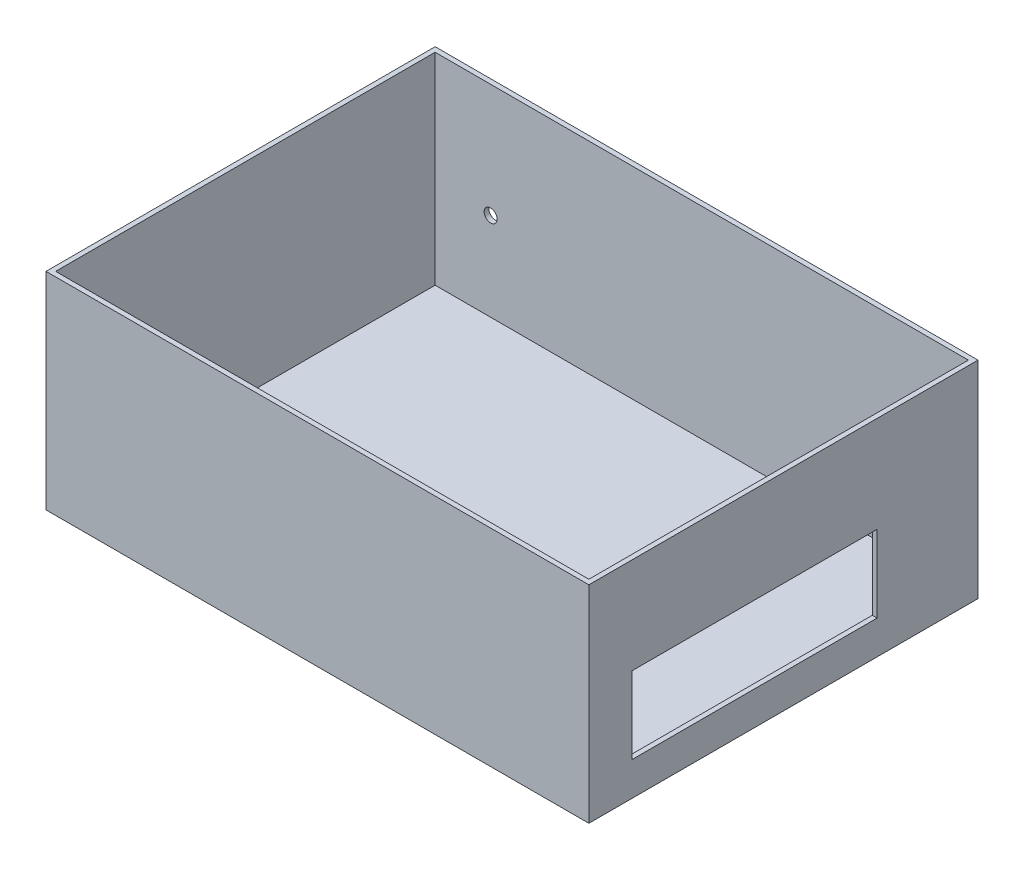
from build123d import *

# Parameters (mm, degrees)
SKETCH1_W           = 113
SKETCH1_H           = 81
BOSS_EXTRUDE1_DEPTH = 1
SKETCH2_W           = 113
SKETCH2_H           = 81
SKETCH2_W_2         = 111
SKETCH2_H_2         = 79
BOSS_EXTRUDE3_DEPTH = 42
CUT_EXTRUDE2_REACH  = 129.508
SKETCH3_W           = 51
SKETCH3_H           = 16
SKETCH4_R           = 1.55
SKETCH4_R_2         = 0.55
BOSS_EXTRUDE4_DEPTH = 1.1
CUT_EXTRUDE3_REACH  = 109.714
SKETCH6_R           = 1.35


with BuildPart() as part:
    # Sketch1 → Boss-Extrude1 (new body)
    with BuildSketch(Plane(origin=(0, 0, 0), x_dir=(1, 0, 0), z_dir=(0, 1, 0))):
        Rectangle(SKETCH1_W, SKETCH1_H)
    extrude(amount=BOSS_EXTRUDE1_DEPTH)

    # Sketch2 → Boss-Extrude3 (add)
    with BuildSketch(Plane(origin=(0, 1, 0), x_dir=(1, 0, 0), z_dir=(0, 1, 0))):
        Rectangle(SKETCH2_W, SKETCH2_H)
        Rectangle(SKETCH2_W_2, SKETCH2_H_2, mode=Mode.SUBTRACT)
    extrude(amount=BOSS_EXTRUDE3_DEPTH)

    # Sketch3 → Cut-Extrude2 (cut, up to next)
    with BuildSketch(Plane(origin=(56.5, 0, 0), x_dir=(0, 0, -1), z_dir=(1, 0, 0)), mode=Mode.PRIVATE) as cut_extrude2_sk1:
        with Locations((-6, 15)):
            Rectangle(SKETCH3_W, SKETCH3_H)
    cut_extrude2_tool1 = extrude(cut_extrude2_sk1.sketch, amount=-CUT_EXTRUDE2_REACH, mode=Mode.PRIVATE) & part.part
    add(cut_extrude2_tool1.solids().sort_by_distance((56.5, 15, 6))[0], mode=Mode.SUBTRACT)

    # Sketch4 → Boss-Extrude4 (add)
    # profile 1 of 2: a face of its own
    with BuildSketch(Plane(origin=(0, 1, 0), x_dir=(1, 0, 0), z_dir=(0, 1, 0))):
        with Locations(Location((52.05, 34.25, 0), (0, 0, 90))):
            Circle(SKETCH4_R)
        with Locations(Location((52.05, 34.25, 0), (0, 0, 270))):
            Circle(SKETCH4_R_2, mode=Mode.SUBTRACT)
    # profile 2 of 2: a face of its own
    with BuildSketch(Plane(origin=(0, 1, 0), x_dir=(1, 0, 0), z_dir=(0, 1, 0))):
        with Locations(Location((-52.05, -35.5, 0), (0, 0, 90))):
            Circle(SKETCH4_R)
        with Locations(Location((-52.05, -35.5, 0), (0, 0, 270))):
            Circle(SKETCH4_R_2, mode=Mode.SUBTRACT)
    extrude(amount=BOSS_EXTRUDE4_DEPTH)

    # Sketch6 → Cut-Extrude3 (cut, up to next)
    with BuildSketch(Plane(origin=(0, 0, -40.5), x_dir=(-1, 0, 0), z_dir=(0, 0, -1)), mode=Mode.PRIVATE) as cut_extrude3_sk1:
        with Locations((-46.35, 24.55)):
            Circle(SKETCH6_R)
    cut_extrude3_tool1 = extrude(cut_extrude3_sk1.sketch, amount=-CUT_EXTRUDE3_REACH, mode=Mode.PRIVATE) & part.part
    # Sketch6 → Cut-Extrude3 (cut, up to next)
    with BuildSketch(Plane(origin=(0, 0, -40.5), x_dir=(-1, 0, 0), z_dir=(0, 0, -1)), mode=Mode.PRIVATE) as cut_extrude3_sk2:
        with Locations((43.95, 19.35)):
            Circle(SKETCH6_R)
    cut_extrude3_tool2 = extrude(cut_extrude3_sk2.sketch, amount=-CUT_EXTRUDE3_REACH, mode=Mode.PRIVATE) & part.part
    add(cut_extrude3_tool1.solids().sort_by_distance((46.35, 24.55, -40.5))[0], mode=Mode.SUBTRACT)
    add(cut_extrude3_tool2.solids().sort_by_distance((-43.95, 19.35, -40.5))[0], mode=Mode.SUBTRACT)


solid = part.part
